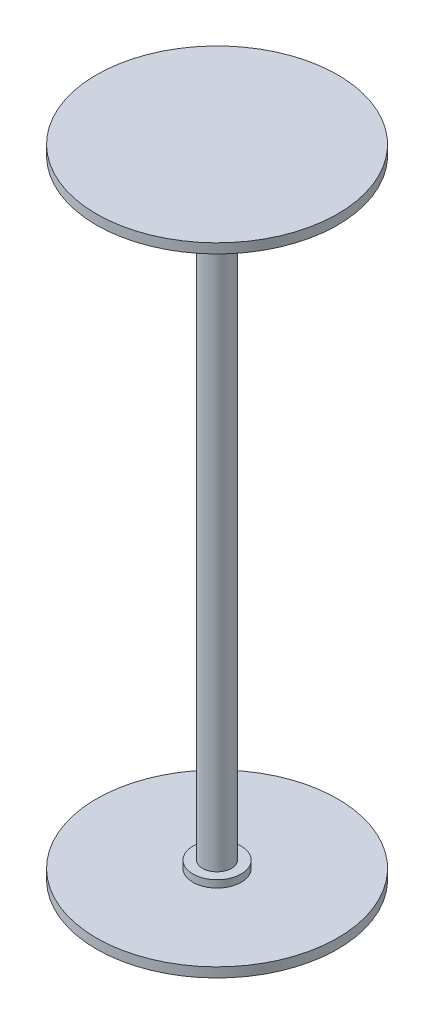
from build123d import *

# Parameters (mm, degrees)
SKETCH1_R           = 25
BOSS_EXTRUDE1_DEPTH = 2
SKETCH2_R           = 5
BOSS_EXTRUDE2_DEPTH = 1.5
SKETCH3_R           = 3
BOSS_EXTRUDE3_DEPTH = 62.5
SKETCH4_R           = 1.05
CUT_EXTRUDE1_DEPTH  = 9


with BuildPart() as part:
    # Sketch1 → Boss-Extrude1 (new body)
    with BuildSketch(Plane(origin=(0, 0, 0), x_dir=(1, 0, 0), z_dir=(0, 1, 0))):
        with Locations(Location((0, 0, 0), (0, 0, 270))):
            Circle(SKETCH1_R)
    extrude(amount=BOSS_EXTRUDE1_DEPTH)

    # Sketch2 → Boss-Extrude2 (add)
    with BuildSketch(Plane(origin=(0, 2, 0), x_dir=(1, 0, 0), z_dir=(0, 1, 0))):
        with Locations(Location((0, 0, 0), (0, 0, 270))):
            Circle(SKETCH2_R)
    extrude(amount=BOSS_EXTRUDE2_DEPTH)

    # Sketch3 → Boss-Extrude3 (add)
    with BuildSketch(Plane(origin=(0, 3.5, 0), x_dir=(1, 0, 0), z_dir=(0, 1, 0))):
        with Locations(Location((0, 0, 0), (0, 0, 270))):
            Circle(SKETCH3_R)
    extrude(amount=BOSS_EXTRUDE3_DEPTH)

    # Sketch4 → Cut-Extrude1 (cut)
    with BuildSketch(Plane(origin=(0, 66, 0), x_dir=(1, 0, 0), z_dir=(0, 1, 0))):
        with Locations(Location((0, 0, 0), (0, 0, 270))):
            Circle(SKETCH4_R)
    extrude(amount=-CUT_EXTRUDE1_DEPTH, mode=Mode.SUBTRACT)

    # Mirror6: part across plane


with BuildPart() as part_1:
    add(part.part)
    add(part.part.mirror(Plane.ZX.offset(66)))


solid = part_1.part
